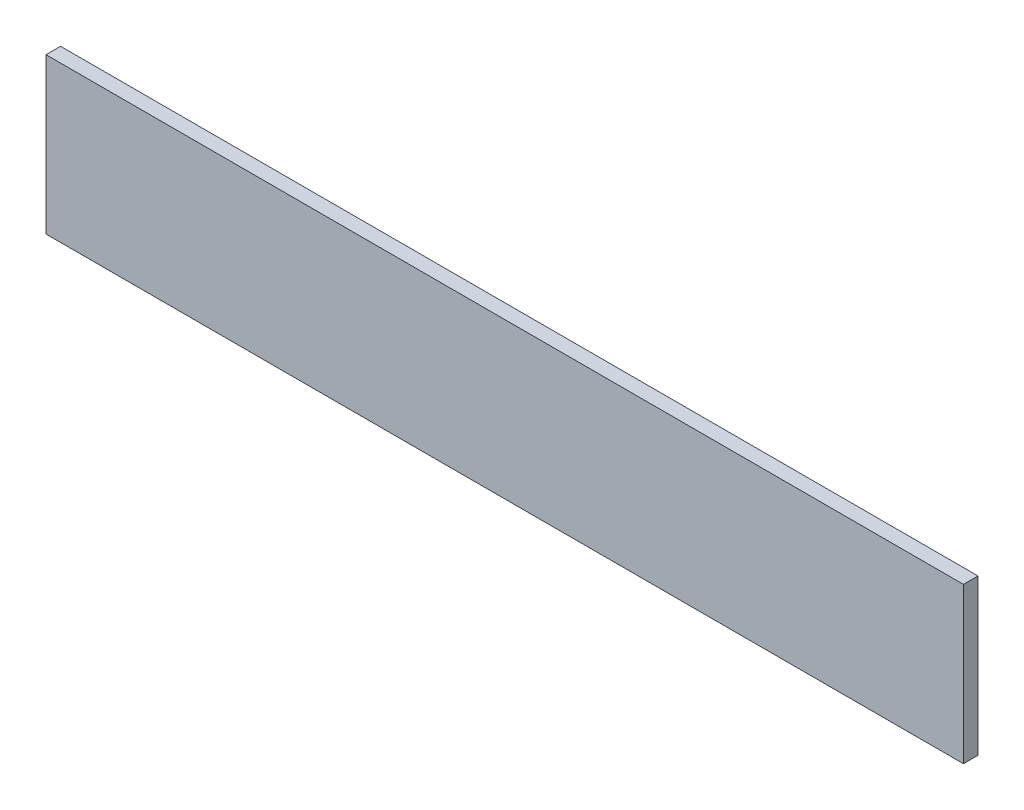
from build123d import *

# Parameters (mm, degrees)
SKETCH_1_W      = 189
SKETCH_1_H      = 32
EXTRUDE_1_DEPTH = 1.5


with BuildPart() as part:
    # 草图1 → 凸台-拉伸1 (new, symmetric)
    with BuildSketch(Plane.XY):
        Rectangle(SKETCH_1_W, SKETCH_1_H)
    extrude(amount=EXTRUDE_1_DEPTH, both=True)


solid = part.part
